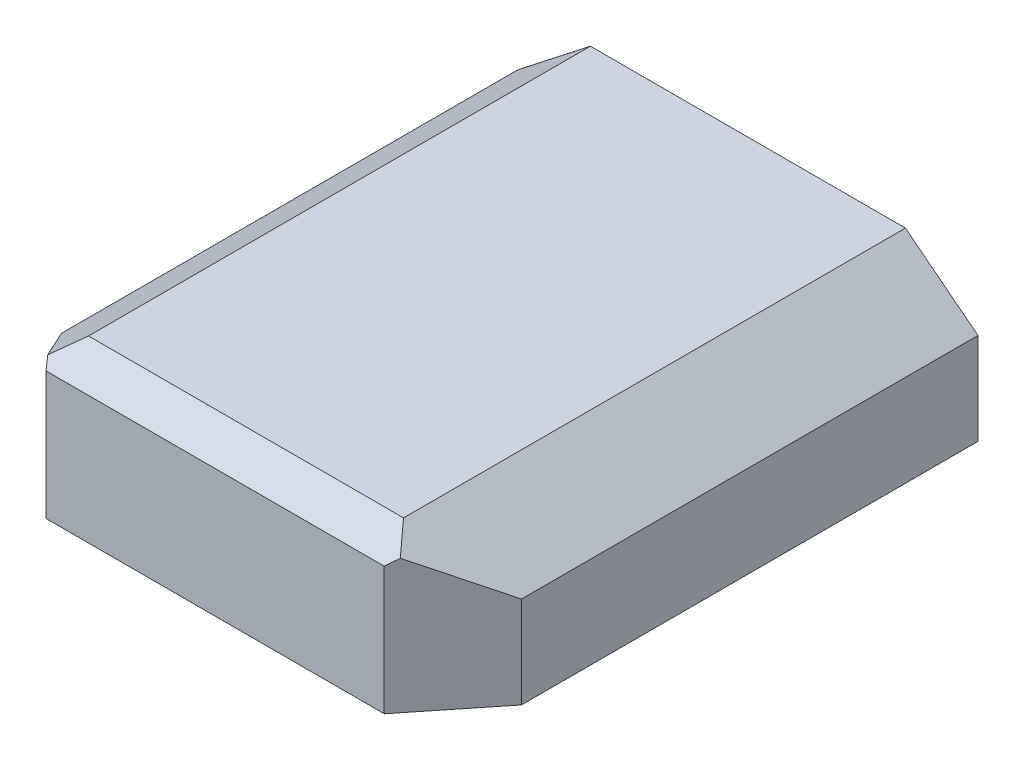
from build123d import *

# Parameters (mm, degrees)
Y_KSEKLIK_EKSTR_ZYON1_DEPTH      = 173
Y_KSEKLIK_EKSTR_ZYON1_DEPTH_BACK = 4.8
KES_EKSTR_ZYON3_DEPTH            = 196.216977169
KES_EKSTR_ZYON3_DEPTH_BACK       = 196.216977169
KES_EKSTR_ZYON6_DEPTH            = 196.216977169
KES_EKSTR_ZYON6_DEPTH_BACK       = 196.216977169
Y_KSEKLIK_EKSTR_ZYON3_DEPTH      = 3
Y_KSEKLIK_EKSTR_ZYON4_DEPTH      = 3
Y_KSEKLIK_EKSTR_ZYON5_DEPTH      = 3
IZIM12_W                         = 111.728887866
IZIM12_H                         = 42.234305359
Y_KSEKLIK_EKSTR_ZYON6_DEPTH      = 3
Y_KSEKLIK_EKSTR_ZYON7_DEPTH      = 3


with BuildPart() as part:
    # Çizim1 → Yükseklik-Ekstrüzyon1 (new, two sides: drawn at the far end of the back side and taken through both)
    with BuildSketch(Plane.XY.offset(-Y_KSEKLIK_EKSTR_ZYON1_DEPTH_BACK)):
        Polygon((52.033537584, 49.037416071), (-52.033537584, 49.037416071), (-76, 30.3), (-76, 0), (-73, 0), (-73, 28.837416071), (-51, 46.037416071), (51, 46.037416071), (73, 28.837416071), (73, 0), (76, 0), (76, 30.3), align=None)
    extrude(amount=Y_KSEKLIK_EKSTR_ZYON1_DEPTH + Y_KSEKLIK_EKSTR_ZYON1_DEPTH_BACK)

    # Çizim5 → Kes-Ekstrüzyon3 (cut, two sides: drawn at the far end of the back side and taken through both)
    with BuildSketch(Plane(origin=(0, 0, 0), x_dir=(0, 0, -1), z_dir=(1, 0, 0)).offset(-KES_EKSTR_ZYON3_DEPTH_BACK)):
        Polygon((-158, 49.037416071), (-173, 39.037416071), (-173, 49.037416071), align=None)
    extrude(amount=KES_EKSTR_ZYON3_DEPTH + KES_EKSTR_ZYON3_DEPTH_BACK, mode=Mode.SUBTRACT)

    # Çizim6 → Kes-Ekstrüzyon6 (cut, two sides: drawn at the far end of the back side and taken through both)
    with BuildSketch(Plane(origin=(0, 0, 0), x_dir=(1, 0, 0), z_dir=(0, 1, 0)).offset(-KES_EKSTR_ZYON6_DEPTH_BACK)):
        Polygon((76, -143), (76, -173), (52.033537584, -173), align=None)
        Polygon((-52.033537584, -173), (-76, -143), (-76, -173), align=None)
    extrude(amount=KES_EKSTR_ZYON6_DEPTH + KES_EKSTR_ZYON6_DEPTH_BACK, mode=Mode.SUBTRACT)

    # Çizim7 → Yükseklik-Ekstrüzyon3 (add)
    with BuildSketch(Plane(origin=(0, 106.87205728, 71.248038187), x_dir=(1, 0, 0), z_dir=(0, 0.8320502943378435, 0.5547001962252296))):
        Polygon((-55.864443933, -116.52736444), (55.864443933, -116.52736444), (58.220440286, -112.982967479), (52.033537584, -104.262882189), (-52.033537584, -104.262882189), (-58.220440286, -112.982967479), align=None)
    extrude(amount=-Y_KSEKLIK_EKSTR_ZYON3_DEPTH)

    # Çizim9 → Yükseklik-Ekstrüzyon4 (add)
    with BuildSketch(Plane(origin=(-116.126649253, 0, 92.771499161), x_dir=(0.6241623263226247, 0, 0.7812946885775748), z_dir=(-0.7812946885775748, 0, 0.6241623263226247))):
        Polygon((92.774277659, 44.200383049), (96.548930908, 42.234305359), (96.548930908, 0), (64.288803666, 0), (64.288803666, 30.3), align=None)
    extrude(amount=-Y_KSEKLIK_EKSTR_ZYON4_DEPTH)

    # Çizim10 → Yükseklik-Ekstrüzyon5 (add)
    with BuildSketch(Plane(origin=(116.126649253, 0, 92.771499161), x_dir=(0.6241623263226247, 0, -0.7812946885775748), z_dir=(0.7812946885775748, 0, 0.6241623263226247))):
        Polygon((-96.548930908, 42.234305359), (-96.548930908, 0), (-64.288803666, 0), (-64.288803666, 30.3), (-92.774277659, 44.200383049), align=None)
    extrude(amount=-Y_KSEKLIK_EKSTR_ZYON5_DEPTH)

    # Çizim12 → Yükseklik-Ekstrüzyon6 (add)
    with BuildSketch(Plane(origin=(0, 0, 168.2), x_dir=(-1, 0, 0), z_dir=(0, 0, -1))):
        with Locations((0, 21.11715268)):
            Rectangle(IZIM12_W, IZIM12_H)
    extrude(amount=Y_KSEKLIK_EKSTR_ZYON6_DEPTH)

    # Çizim13 → Yükseklik-Ekstrüzyon7 (add)
    with BuildSketch(Plane(origin=(0, 0, -4.8), x_dir=(-1, 0, 0), z_dir=(0, 0, -1))):
        Polygon((-76, 30.3), (-52.033537584, 49.037416071), (52.033537584, 49.037416071), (76, 30.3), (76, 0), (42.425, 0), (42.425, -10), (-42.425, -10), (-42.425, 0), (-76, 0), align=None)
    extrude(amount=Y_KSEKLIK_EKSTR_ZYON7_DEPTH)


solid = part.part
